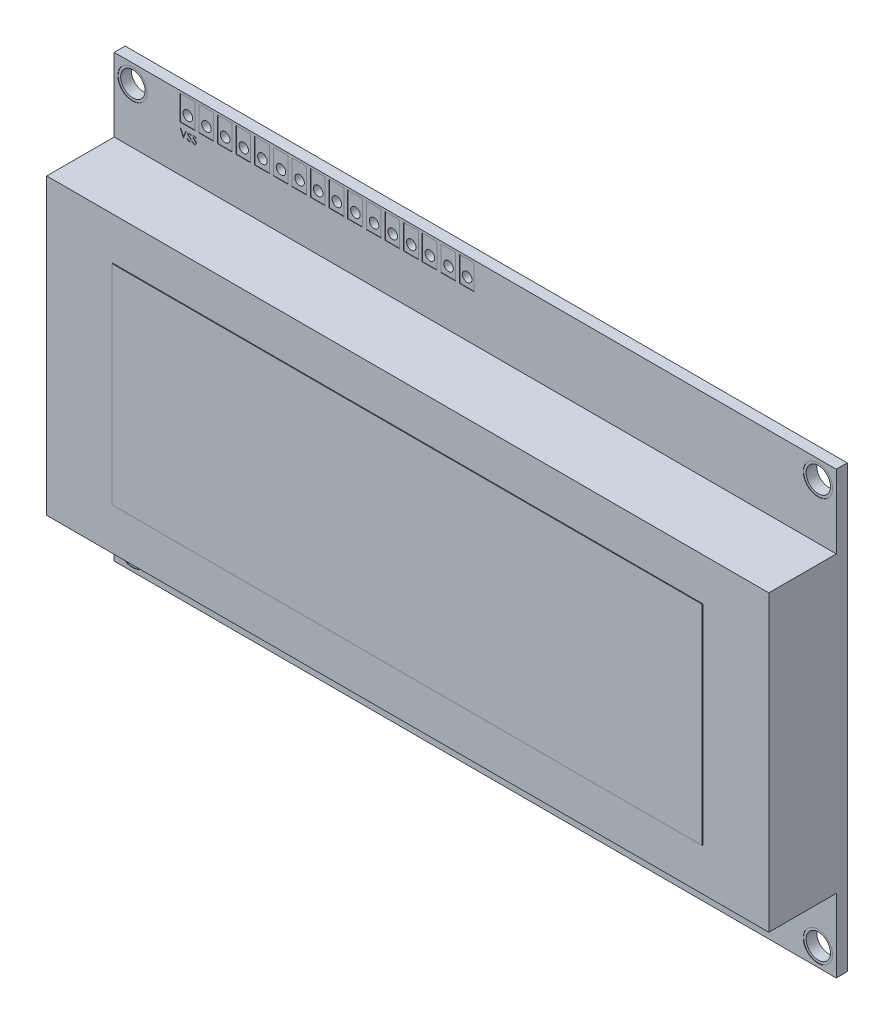
from build123d import *

# Parameters (mm, degrees)
SKETCH1_W           = 98.5
SKETCH1_H           = 60.1
SKETCH1_R           = 1.665
SKETCH1_R_2         = 0.65
BOSS_EXTRUDE1_DEPTH = 0.75
SKETCH2_W           = 98.5
SKETCH2_H           = 40.1
BOSS_EXTRUDE2_DEPTH = 9.2
SKETCH3_W           = 80.5
SKETCH3_H           = 28.5
BOSS_EXTRUDE3_DEPTH = 0.1
SKETCH4_R           = 2.002768579
SKETCH4_W           = 2
SKETCH4_H           = 3.4
CUT_EXTRUDE1_DEPTH  = 0.05
CUT_EXTRUDE2_DEPTH  = 0.05


with BuildPart() as part:
    # Sketch1 → Boss-Extrude1 (new, symmetric)
    with BuildSketch(Plane.XY):
        Rectangle(SKETCH1_W, SKETCH1_H)
        with Locations((-46.75, 27.55)):
            Circle(SKETCH1_R, mode=Mode.SUBTRACT)
        with Locations((46.75, 27.55)):
            Circle(SKETCH1_R, mode=Mode.SUBTRACT)
        with Locations((-46.75, -27.55)):
            Circle(SKETCH1_R, mode=Mode.SUBTRACT)
        with Locations((46.75, -27.55)):
            Circle(SKETCH1_R, mode=Mode.SUBTRACT)
        with Locations((-39.25, 27.55)):
            Circle(SKETCH1_R_2, mode=Mode.SUBTRACT)
        with Locations((-36.71, 27.55)):
            Circle(SKETCH1_R_2, mode=Mode.SUBTRACT)
        with Locations((-34.17, 27.55)):
            Circle(SKETCH1_R_2, mode=Mode.SUBTRACT)
        with Locations((-31.63, 27.55)):
            Circle(SKETCH1_R_2, mode=Mode.SUBTRACT)
        with Locations((-29.09, 27.55)):
            Circle(SKETCH1_R_2, mode=Mode.SUBTRACT)
        with Locations((-26.55, 27.55)):
            Circle(SKETCH1_R_2, mode=Mode.SUBTRACT)
        with Locations((-24.01, 27.55)):
            Circle(SKETCH1_R_2, mode=Mode.SUBTRACT)
        with Locations((-21.47, 27.55)):
            Circle(SKETCH1_R_2, mode=Mode.SUBTRACT)
        with Locations((-18.93, 27.55)):
            Circle(SKETCH1_R_2, mode=Mode.SUBTRACT)
        with Locations((-16.39, 27.55)):
            Circle(SKETCH1_R_2, mode=Mode.SUBTRACT)
        with Locations((-13.85, 27.55)):
            Circle(SKETCH1_R_2, mode=Mode.SUBTRACT)
        with Locations((-11.31, 27.55)):
            Circle(SKETCH1_R_2, mode=Mode.SUBTRACT)
        with Locations((-8.77, 27.55)):
            Circle(SKETCH1_R_2, mode=Mode.SUBTRACT)
        with Locations((-6.23, 27.55)):
            Circle(SKETCH1_R_2, mode=Mode.SUBTRACT)
        with Locations((-3.69, 27.55)):
            Circle(SKETCH1_R_2, mode=Mode.SUBTRACT)
        with Locations((-1.15, 27.55)):
            Circle(SKETCH1_R_2, mode=Mode.SUBTRACT)
    extrude(amount=BOSS_EXTRUDE1_DEPTH, both=True)

    # Sketch2 → Boss-Extrude2 (add)
    with BuildSketch(Plane.XY.offset(0.75)):
        Rectangle(SKETCH2_W, SKETCH2_H)
    extrude(amount=BOSS_EXTRUDE2_DEPTH)

    # Sketch3 → Boss-Extrude3 (add)
    with BuildSketch(Plane.XY.offset(9.95)):
        Rectangle(SKETCH3_W, SKETCH3_H)
    extrude(amount=BOSS_EXTRUDE3_DEPTH)

    # Sketch4 → Cut-Extrude1 (cut)
    with BuildSketch(Plane.XY.offset(0.75)):
        with Locations((-46.75, 27.55)):
            Circle(SKETCH4_R)
        with Locations((46.75, 27.55)):
            Circle(SKETCH4_R)
        with Locations((46.75, -27.55)):
            Circle(SKETCH4_R)
        with Locations((-46.75, -27.55)):
            Circle(SKETCH4_R)
        with Locations((-36.71, 28.01685787)):
            Rectangle(SKETCH4_W, SKETCH4_H)
        with Locations((-39.25, 28.01685787)):
            Rectangle(SKETCH4_W, SKETCH4_H)
        with Locations((-34.17, 28.01685787)):
            Rectangle(SKETCH4_W, SKETCH4_H)
        with Locations((-31.63, 28.01685787)):
            Rectangle(SKETCH4_W, SKETCH4_H)
        with Locations((-29.09, 28.01685787)):
            Rectangle(SKETCH4_W, SKETCH4_H)
        with Locations((-26.55, 28.01685787)):
            Rectangle(SKETCH4_W, SKETCH4_H)
        with Locations((-24.01, 28.01685787)):
            Rectangle(SKETCH4_W, SKETCH4_H)
        with Locations((-21.47, 28.01685787)):
            Rectangle(SKETCH4_W, SKETCH4_H)
        with Locations((-18.93, 28.01685787)):
            Rectangle(SKETCH4_W, SKETCH4_H)
        with Locations((-16.39, 28.01685787)):
            Rectangle(SKETCH4_W, SKETCH4_H)
        with Locations((-13.85, 28.01685787)):
            Rectangle(SKETCH4_W, SKETCH4_H)
        with Locations((-11.31, 28.01685787)):
            Rectangle(SKETCH4_W, SKETCH4_H)
        with Locations((-8.77, 28.01685787)):
            Rectangle(SKETCH4_W, SKETCH4_H)
        with Locations((-6.23, 28.01685787)):
            Rectangle(SKETCH4_W, SKETCH4_H)
        with Locations((-3.69, 28.01685787)):
            Rectangle(SKETCH4_W, SKETCH4_H)
        with Locations((-1.15, 28.01685787)):
            Rectangle(SKETCH4_W, SKETCH4_H)
    extrude(amount=-CUT_EXTRUDE1_DEPTH, mode=Mode.SUBTRACT)

    # Sketch5 → Cut-Extrude2 (cut)
    with BuildSketch(Plane.XY.offset(0.75)):
        Polygon((-40.222689776, 25.635587016), (-40.12653593, 25.635587016), (-39.793202597, 24.847526118), (-39.459869264, 25.635587016), (-39.363715417, 25.635587016), (-39.786792341, 24.635587016), (-39.799612853, 24.635587016), align=None)
        with BuildLine():
            Line((-39.286792341, 24.828495669), (-39.202257084, 24.879176759))
            add(Edge.make_bspline(
                [(-39.202257084, 24.879176759), (-39.194394731, 24.866015506), (-39.179330765, 24.840799054), (-39.154201805, 24.806725328), (-39.12816383, 24.777764712), (-39.101024021, 24.754085681), (-39.072948036, 24.735443142), (-39.043752592, 24.722242504), (-39.013536074, 24.714009369), (-38.992972125, 24.713009344), (-38.982705802, 24.712510093)],
                knots=[0, 0, 0, 0, 1.272034388, 2.437168799, 3.508375237, 4.49857839, 5.41946034, 6.295179144, 7.148887113, 8, 8, 8, 8], degree=3))
            add(Edge.make_bspline(
                [(-38.982705802, 24.712510093), (-38.973938128, 24.712754285), (-38.956556192, 24.713238396), (-38.93096698, 24.717890054), (-38.906115037, 24.725036376), (-38.882512569, 24.735270928), (-38.86048525, 24.747653353), (-38.841169052, 24.762609404), (-38.824470162, 24.779354034), (-38.810810415, 24.798034792), (-38.800330405, 24.818125406), (-38.792275528, 24.838747106), (-38.787805507, 24.86022384), (-38.787132149, 24.874683973), (-38.786792341, 24.881981246)],
                knots=[0, 0, 0, 0, 1.095163259, 2.171163733, 3.241058638, 4.321873601, 5.38011039, 6.391990106, 7.366004449, 8.327778327, 9.272591725, 10.192022065, 11.087607919, 12, 12, 12, 12], degree=3))
            add(Edge.make_bspline(
                [(-38.786792341, 24.881981246), (-38.787213572, 24.890307203), (-38.788069875, 24.907232657), (-38.79530744, 24.932203987), (-38.806692939, 24.95691615), (-38.817196552, 24.972202226), (-38.822649712, 24.980138298)],
                knots=[0, 0, 0, 0, 0.938893495, 1.908633276, 2.914225137, 4, 4, 4, 4], degree=3))
            add(Edge.make_bspline(
                [(-38.822649712, 24.980138298), (-38.827127031, 24.985865962), (-38.8365266, 24.997890475), (-38.85268589, 25.015789114), (-38.871647637, 25.03425152), (-38.892762938, 25.053982679), (-38.916800964, 25.074064906), (-38.943008825, 25.095455843), (-38.972055642, 25.117342008), (-38.992426926, 25.132019884), (-39.002938174, 25.139593426)],
                knots=[0, 0, 0, 0, 0.722233717, 1.516239348, 2.393582979, 3.351407094, 4.387010283, 5.505090956, 6.712668013, 8, 8, 8, 8], degree=3))
            add(Edge.make_bspline(
                [(-39.002938174, 25.139593426), (-39.013459316, 25.147087308), (-39.033574938, 25.16141504), (-39.061705961, 25.182679121), (-39.086861522, 25.202120227), (-39.108929812, 25.219921373), (-39.127901126, 25.236084975), (-39.143924957, 25.250455814), (-39.156593117, 25.263422546), (-39.163637568, 25.271834358), (-39.166800353, 25.275611054)],
                knots=[0, 0, 0, 0, 1.452282411, 2.77665338, 3.964542531, 5.026858415, 5.96415736, 6.766646006, 7.446254459, 8, 8, 8, 8], degree=3))
            add(Edge.make_bspline(
                [(-39.166800353, 25.275611054), (-39.171221081, 25.281497065), (-39.179915034, 25.293072694), (-39.191391035, 25.311165511), (-39.201145082, 25.329686444), (-39.208791463, 25.348685262), (-39.215230382, 25.367895242), (-39.21956122, 25.387567026), (-39.222273047, 25.407612346), (-39.222550758, 25.421101918), (-39.222689776, 25.427854644)],
                knots=[0, 0, 0, 0, 1.068054152, 2.10047183, 3.106115577, 4.101338837, 5.06977816, 6.043150881, 7.020423561, 8, 8, 8, 8], degree=3))
            add(Edge.make_bspline(
                [(-39.222689776, 25.427854644), (-39.22231686, 25.438434579), (-39.221578997, 25.459368312), (-39.215338849, 25.489948549), (-39.205489451, 25.519144668), (-39.191690911, 25.546667621), (-39.173903096, 25.571800758), (-39.153318532, 25.594833183), (-39.128800965, 25.614195635), (-39.101900215, 25.631113366), (-39.072455537, 25.644355059), (-39.041600994, 25.654343911), (-39.009287544, 25.660003698), (-38.987400934, 25.660815917), (-38.976295546, 25.661228041)],
                knots=[0, 0, 0, 0, 1.005424448, 1.989358655, 2.955360095, 3.929531133, 4.905563448, 5.876582895, 6.856512386, 7.866279853, 8.892233794, 9.918561126, 10.94386622, 12, 12, 12, 12], degree=3))
            add(Edge.make_bspline(
                [(-38.976295546, 25.661228041), (-38.964511517, 25.660821598), (-38.941076845, 25.660013312), (-38.906605641, 25.652985446), (-38.873416865, 25.641356682), (-38.846718789, 25.628159923), (-38.825823714, 25.614979519), (-38.809888648, 25.602973854), (-38.793740805, 25.589152395), (-38.777249932, 25.573478325), (-38.760695458, 25.555807824), (-38.743831614, 25.536261913), (-38.726618966, 25.51496004), (-38.715545863, 25.49975304), (-38.709869264, 25.491957208)],
                knots=[0, 0, 0, 0, 1.286793592, 2.559021753, 3.825965368, 5.121522368, 5.803751409, 6.523245864, 7.299691795, 8.125521123, 9.008227632, 9.944561021, 10.946284179, 12, 12, 12, 12], degree=3))
            Line((-38.709869264, 25.491957208), (-38.790999071, 25.43045881))
            add(Edge.make_bspline(
                [(-38.790999071, 25.43045881), (-38.795897909, 25.436769865), (-38.805331925, 25.44892348), (-38.819654636, 25.465943856), (-38.83315425, 25.481491422), (-38.846454364, 25.494995744), (-38.858852544, 25.507196353), (-38.870885985, 25.517641998), (-38.882381514, 25.526435025), (-38.89687206, 25.5358189), (-38.915077122, 25.545120758), (-38.937929847, 25.552991923), (-38.96181164, 25.557721941), (-38.978077249, 25.558347337), (-38.986311571, 25.558663939)],
                knots=[0, 0, 0, 0, 1.181633172, 2.275549214, 3.290209073, 4.226197932, 5.078386478, 5.862611352, 6.581680152, 7.217281963, 8.414376989, 9.595101626, 10.782541182, 12, 12, 12, 12], degree=3))
            add(Edge.make_bspline(
                [(-38.986311571, 25.558663939), (-38.996642006, 25.558317739), (-39.016563277, 25.557650125), (-39.044846202, 25.5503587), (-39.070301609, 25.538878169), (-39.09217377, 25.522788175), (-39.110384335, 25.503725034), (-39.123557323, 25.481788219), (-39.131485942, 25.457564675), (-39.13245345, 25.440667059), (-39.132946187, 25.432061375)],
                knots=[0, 0, 0, 0, 1.14458467, 2.207223713, 3.21896685, 4.227309161, 5.202851033, 6.127160689, 7.046193047, 8, 8, 8, 8], degree=3))
            add(Edge.make_bspline(
                [(-39.132946187, 25.432061375), (-39.132833865, 25.426703809), (-39.132609037, 25.415979918), (-39.129473381, 25.400136655), (-39.125445001, 25.384333415), (-39.119061392, 25.368641248), (-39.110248448, 25.352785717), (-39.098675541, 25.336493792), (-39.084100309, 25.319621875), (-39.072935448, 25.30864834), (-39.067040738, 25.302854644)],
                knots=[0, 0, 0, 0, 0.858281714, 1.717966888, 2.583508476, 3.4729293, 4.427298488, 5.488583878, 6.674047936, 8, 8, 8, 8], degree=3))
            add(Edge.make_bspline(
                [(-39.067040738, 25.302854644), (-39.064851774, 25.300901208), (-39.059651298, 25.296260291), (-39.050143891, 25.288662497), (-39.037588806, 25.279290276), (-39.022313891, 25.2676939), (-39.004037502, 25.254242054), (-38.982757629, 25.239106736), (-38.958711476, 25.221796605), (-38.941648072, 25.20969445), (-38.932625674, 25.203295349)],
                knots=[0, 0, 0, 0, 0.420754252, 0.999615792, 1.744751191, 2.668019286, 3.750313428, 4.999500688, 6.413464383, 8, 8, 8, 8], degree=3))
            add(Edge.make_bspline(
                [(-38.932625674, 25.203295349), (-38.921772556, 25.195397818), (-38.900756997, 25.180105343), (-38.870854831, 25.157129434), (-38.843742315, 25.134658643), (-38.819324256, 25.11283647), (-38.797359425, 25.091828443), (-38.778091505, 25.07138182), (-38.761324168, 25.051643085), (-38.743272963, 25.026336635), (-38.724827871, 24.995256325), (-38.708987441, 24.957176829), (-38.698999341, 24.918949308), (-38.697693194, 24.893255927), (-38.697048751, 24.880579003)],
                knots=[0, 0, 0, 0, 1.163667725, 2.253281268, 3.268753668, 4.215851969, 5.092017293, 5.902905408, 6.650798638, 7.335211899, 8.59617414, 9.77448103, 10.901945474, 12, 12, 12, 12], degree=3))
            add(Edge.make_bspline(
                [(-38.697048751, 24.880579003), (-38.697236505, 24.871613756), (-38.697608366, 24.85385736), (-38.701882913, 24.827784481), (-38.708145674, 24.802461376), (-38.717584884, 24.778201058), (-38.729105786, 24.754559697), (-38.743724714, 24.73215744), (-38.760669767, 24.710498469), (-38.780107986, 24.690160328), (-38.801378243, 24.671489987), (-38.823859299, 24.654881683), (-38.847587948, 24.641033591), (-38.872435467, 24.62973335), (-38.898407564, 24.620895202), (-38.925495502, 24.614491526), (-38.953743934, 24.610561322), (-38.972944071, 24.610153391), (-38.982705802, 24.60994599)],
                knots=[0, 0, 0, 0, 0.983748083, 1.948392443, 2.894712957, 3.844097841, 4.80183111, 5.778335162, 6.776009319, 7.81870978, 8.863265674, 9.881300176, 10.883814829, 11.87499822, 12.874611388, 13.892143829, 14.928324115, 16, 16, 16, 16], degree=3))
            add(Edge.make_bspline(
                [(-38.982705802, 24.60994599), (-38.990258757, 24.610092042), (-39.005269546, 24.610382306), (-39.027472255, 24.612948386), (-39.049226423, 24.616578987), (-39.070259075, 24.622343007), (-39.090841193, 24.629336429), (-39.11088326, 24.637947382), (-39.13039499, 24.648266582), (-39.149485728, 24.66006516), (-39.16810692, 24.673795945), (-39.186083911, 24.689788372), (-39.204006536, 24.707601374), (-39.221345792, 24.727718677), (-39.238452404, 24.749815273), (-39.254989093, 24.774097896), (-39.271298155, 24.800434283), (-39.281531146, 24.818967165), (-39.286792341, 24.828495669)],
                knots=[0, 0, 0, 0, 0.915332311, 1.819136955, 2.706846663, 3.586547465, 4.459518054, 5.340707479, 6.227863349, 7.133153174, 8.059268498, 9.028702269, 10.047606654, 11.120612155, 12.245963614, 13.433783089, 14.680604001, 16, 16, 16, 16], degree=3))
        make_face()
        with BuildLine():
            Line((-38.594484648, 24.828495669), (-38.509949392, 24.879176759))
            add(Edge.make_bspline(
                [(-38.509949392, 24.879176759), (-38.502087038, 24.866015506), (-38.487023072, 24.840799054), (-38.461894113, 24.806725328), (-38.435856138, 24.777764712), (-38.408716328, 24.754085681), (-38.380640343, 24.735443142), (-38.351444899, 24.722242504), (-38.321228382, 24.714009369), (-38.300664433, 24.713009344), (-38.29039811, 24.712510093)],
                knots=[0, 0, 0, 0, 1.272034388, 2.437168799, 3.508375237, 4.49857839, 5.41946034, 6.295179144, 7.148887113, 8, 8, 8, 8], degree=3))
            add(Edge.make_bspline(
                [(-38.29039811, 24.712510093), (-38.281630435, 24.712754285), (-38.2642485, 24.713238396), (-38.238659288, 24.717890054), (-38.213807344, 24.725036376), (-38.190204876, 24.735270928), (-38.168177558, 24.747653353), (-38.148861359, 24.762609404), (-38.13216247, 24.779354034), (-38.118502723, 24.798034792), (-38.108022713, 24.818125406), (-38.099967836, 24.838747106), (-38.095497815, 24.86022384), (-38.094824457, 24.874683973), (-38.094484648, 24.881981246)],
                knots=[0, 0, 0, 0, 1.095163259, 2.171163733, 3.241058638, 4.321873601, 5.38011039, 6.391990106, 7.366004449, 8.327778327, 9.272591725, 10.192022065, 11.087607919, 12, 12, 12, 12], degree=3))
            add(Edge.make_bspline(
                [(-38.094484648, 24.881981246), (-38.09490588, 24.890307203), (-38.095762182, 24.907232657), (-38.102999748, 24.932203987), (-38.114385247, 24.95691615), (-38.12488886, 24.972202226), (-38.13034202, 24.980138298)],
                knots=[0, 0, 0, 0, 0.938893495, 1.908633276, 2.914225137, 4, 4, 4, 4], degree=3))
            add(Edge.make_bspline(
                [(-38.13034202, 24.980138298), (-38.134819338, 24.985865962), (-38.144218908, 24.997890475), (-38.160378197, 25.015789114), (-38.179339944, 25.03425152), (-38.200455246, 25.053982679), (-38.224493271, 25.074064906), (-38.250701132, 25.095455843), (-38.279747949, 25.117342008), (-38.300119234, 25.132019884), (-38.310630482, 25.139593426)],
                knots=[0, 0, 0, 0, 0.722233717, 1.516239348, 2.393582979, 3.351407094, 4.387010283, 5.505090956, 6.712668013, 8, 8, 8, 8], degree=3))
            add(Edge.make_bspline(
                [(-38.310630482, 25.139593426), (-38.321151623, 25.147087308), (-38.341267245, 25.16141504), (-38.369398269, 25.182679121), (-38.39455383, 25.202120227), (-38.41662212, 25.219921373), (-38.435593433, 25.236084975), (-38.451617265, 25.250455814), (-38.464285424, 25.263422546), (-38.471329876, 25.271834358), (-38.474492661, 25.275611054)],
                knots=[0, 0, 0, 0, 1.452282411, 2.77665338, 3.964542531, 5.026858415, 5.96415736, 6.766646006, 7.446254459, 8, 8, 8, 8], degree=3))
            add(Edge.make_bspline(
                [(-38.474492661, 25.275611054), (-38.478913388, 25.281497065), (-38.487607342, 25.293072694), (-38.499083343, 25.311165511), (-38.50883739, 25.329686444), (-38.51648377, 25.348685262), (-38.52292269, 25.367895242), (-38.527253527, 25.387567026), (-38.529965355, 25.407612346), (-38.530243065, 25.421101918), (-38.530382084, 25.427854644)],
                knots=[0, 0, 0, 0, 1.068054152, 2.10047183, 3.106115577, 4.101338837, 5.06977816, 6.043150881, 7.020423561, 8, 8, 8, 8], degree=3))
            add(Edge.make_bspline(
                [(-38.530382084, 25.427854644), (-38.530009167, 25.438434579), (-38.529271304, 25.459368312), (-38.523031157, 25.489948549), (-38.513181758, 25.519144668), (-38.499383219, 25.546667621), (-38.481595404, 25.571800758), (-38.46101084, 25.594833183), (-38.436493272, 25.614195635), (-38.409592523, 25.631113366), (-38.380147845, 25.644355059), (-38.349293301, 25.654343911), (-38.316979852, 25.660003698), (-38.295093242, 25.660815917), (-38.283987853, 25.661228041)],
                knots=[0, 0, 0, 0, 1.005424448, 1.989358655, 2.955360095, 3.929531133, 4.905563448, 5.876582895, 6.856512386, 7.866279853, 8.892233794, 9.918561126, 10.94386622, 12, 12, 12, 12], degree=3))
            add(Edge.make_bspline(
                [(-38.283987853, 25.661228041), (-38.272203825, 25.660821598), (-38.248769153, 25.660013312), (-38.214297948, 25.652985446), (-38.181109172, 25.641356682), (-38.154411097, 25.628159923), (-38.133516022, 25.614979519), (-38.117580955, 25.602973854), (-38.101433112, 25.589152395), (-38.084942239, 25.573478325), (-38.068387765, 25.555807824), (-38.051523922, 25.536261913), (-38.034311274, 25.51496004), (-38.023238171, 25.49975304), (-38.017561571, 25.491957208)],
                knots=[0, 0, 0, 0, 1.286793592, 2.559021753, 3.825965368, 5.121522368, 5.803751409, 6.523245864, 7.299691795, 8.125521123, 9.008227632, 9.944561021, 10.946284179, 12, 12, 12, 12], degree=3))
            Line((-38.017561571, 25.491957208), (-38.098691379, 25.43045881))
            add(Edge.make_bspline(
                [(-38.098691379, 25.43045881), (-38.103590217, 25.436769865), (-38.113024233, 25.44892348), (-38.127346944, 25.465943856), (-38.140846557, 25.481491422), (-38.154146672, 25.494995744), (-38.166544852, 25.507196353), (-38.178578293, 25.517641998), (-38.190073822, 25.526435025), (-38.204564367, 25.5358189), (-38.22276943, 25.545120758), (-38.245622154, 25.552991923), (-38.269503947, 25.557721941), (-38.285769556, 25.558347337), (-38.294003879, 25.558663939)],
                knots=[0, 0, 0, 0, 1.181633172, 2.275549214, 3.290209073, 4.226197932, 5.078386478, 5.862611352, 6.581680152, 7.217281963, 8.414376989, 9.595101626, 10.782541182, 12, 12, 12, 12], degree=3))
            add(Edge.make_bspline(
                [(-38.294003879, 25.558663939), (-38.304334314, 25.558317739), (-38.324255585, 25.557650125), (-38.352538509, 25.5503587), (-38.377993916, 25.538878169), (-38.399866078, 25.522788175), (-38.418076643, 25.503725034), (-38.431249631, 25.481788219), (-38.439178249, 25.457564675), (-38.440145758, 25.440667059), (-38.440638494, 25.432061375)],
                knots=[0, 0, 0, 0, 1.14458467, 2.207223713, 3.21896685, 4.227309161, 5.202851033, 6.127160689, 7.046193047, 8, 8, 8, 8], degree=3))
            add(Edge.make_bspline(
                [(-38.440638494, 25.432061375), (-38.440526172, 25.426703809), (-38.440301345, 25.415979918), (-38.437165689, 25.400136655), (-38.433137309, 25.384333415), (-38.4267537, 25.368641248), (-38.417940756, 25.352785717), (-38.406367848, 25.336493792), (-38.391792616, 25.319621875), (-38.380627756, 25.30864834), (-38.374733046, 25.302854644)],
                knots=[0, 0, 0, 0, 0.858281714, 1.717966888, 2.583508476, 3.4729293, 4.427298488, 5.488583878, 6.674047936, 8, 8, 8, 8], degree=3))
            add(Edge.make_bspline(
                [(-38.374733046, 25.302854644), (-38.372544082, 25.300901208), (-38.367343606, 25.296260291), (-38.357836198, 25.288662497), (-38.345281113, 25.279290276), (-38.330006199, 25.2676939), (-38.31172981, 25.254242054), (-38.290449936, 25.239106736), (-38.266403784, 25.221796605), (-38.24934038, 25.20969445), (-38.240317982, 25.203295349)],
                knots=[0, 0, 0, 0, 0.420754252, 0.999615792, 1.744751191, 2.668019286, 3.750313428, 4.999500688, 6.413464383, 8, 8, 8, 8], degree=3))
            add(Edge.make_bspline(
                [(-38.240317982, 25.203295349), (-38.229464863, 25.195397818), (-38.208449305, 25.180105343), (-38.178547139, 25.157129434), (-38.151434622, 25.134658643), (-38.127016564, 25.11283647), (-38.105051733, 25.091828443), (-38.085783813, 25.07138182), (-38.069016476, 25.051643085), (-38.05096527, 25.026336635), (-38.032520179, 24.995256325), (-38.016679748, 24.957176829), (-38.006691649, 24.918949308), (-38.005385502, 24.893255927), (-38.004741058, 24.880579003)],
                knots=[0, 0, 0, 0, 1.163667725, 2.253281268, 3.268753668, 4.215851969, 5.092017293, 5.902905408, 6.650798638, 7.335211899, 8.59617414, 9.77448103, 10.901945474, 12, 12, 12, 12], degree=3))
            add(Edge.make_bspline(
                [(-38.004741058, 24.880579003), (-38.004928812, 24.871613756), (-38.005300674, 24.85385736), (-38.00957522, 24.827784481), (-38.015837982, 24.802461376), (-38.025277192, 24.778201058), (-38.036798094, 24.754559697), (-38.051417022, 24.73215744), (-38.068362075, 24.710498469), (-38.087800293, 24.690160328), (-38.109070551, 24.671489987), (-38.131551607, 24.654881683), (-38.155280256, 24.641033591), (-38.180127775, 24.62973335), (-38.206099871, 24.620895202), (-38.23318781, 24.614491526), (-38.261436241, 24.610561322), (-38.280636379, 24.610153391), (-38.29039811, 24.60994599)],
                knots=[0, 0, 0, 0, 0.983748083, 1.948392443, 2.894712957, 3.844097841, 4.80183111, 5.778335162, 6.776009319, 7.81870978, 8.863265674, 9.881300176, 10.883814829, 11.87499822, 12.874611388, 13.892143829, 14.928324115, 16, 16, 16, 16], degree=3))
            add(Edge.make_bspline(
                [(-38.29039811, 24.60994599), (-38.297951065, 24.610092042), (-38.312961853, 24.610382306), (-38.335164563, 24.612948386), (-38.356918731, 24.616578987), (-38.377951383, 24.622343007), (-38.398533501, 24.629336429), (-38.418575568, 24.637947382), (-38.438087297, 24.648266582), (-38.457178035, 24.66006516), (-38.475799228, 24.673795945), (-38.493776219, 24.689788372), (-38.511698843, 24.707601374), (-38.529038099, 24.727718677), (-38.546144712, 24.749815273), (-38.5626814, 24.774097896), (-38.578990463, 24.800434283), (-38.589223453, 24.818967165), (-38.594484648, 24.828495669)],
                knots=[0, 0, 0, 0, 0.915332311, 1.819136955, 2.706846663, 3.586547465, 4.459518054, 5.340707479, 6.227863349, 7.133153174, 8.059268498, 9.028702269, 10.047606654, 11.120612155, 12.245963614, 13.433783089, 14.680604001, 16, 16, 16, 16], degree=3))
        make_face()
    extrude(amount=-CUT_EXTRUDE2_DEPTH, mode=Mode.SUBTRACT)


solid = part.part
